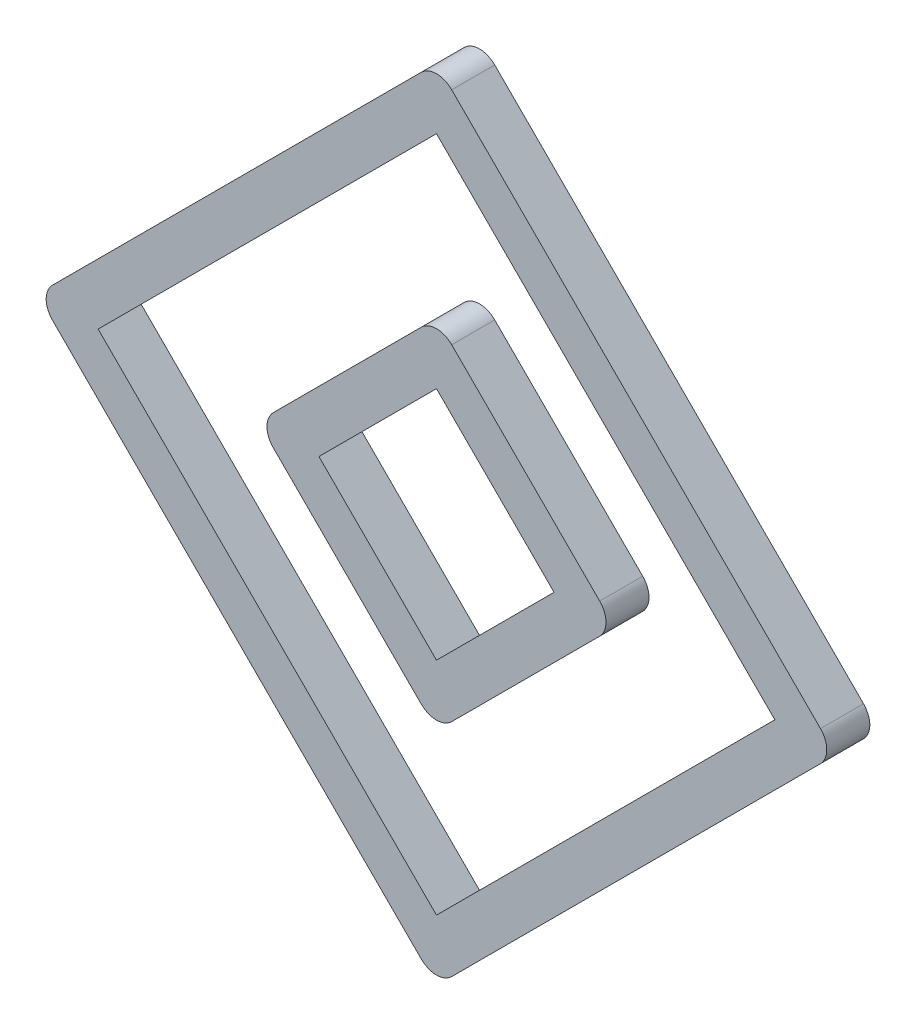
from build123d import *

# Parameters (mm, degrees)
BOSS_EXTRUDE1_DEPTH   = 1.75
BOSS_EXTRUDE1_2_DEPTH = 1.75


with BuildPart() as part:
    # Sketch2 → Boss-Extrude1 (new body)
    with BuildSketch(Plane.XY):
        with BuildLine():
            Line((-22.376246782, -150.652582773), (-7.376246782, -135.652582773))
            ThreePointArc((-7.376246782, -135.652582773), (-7.119965216, -135.03386434), (-7.376246782, -134.415145906))
            Line((-7.376246782, -134.415145906), (-22.376246782, -119.415145906))
            ThreePointArc((-22.376246782, -119.415145906), (-22.994965216, -119.15886434), (-23.613683649, -119.415145906))
            Line((-23.613683649, -119.415145906), (-38.613683649, -134.415145906))
            ThreePointArc((-38.613683649, -134.415145906), (-38.869965216, -135.03386434), (-38.613683649, -135.652582773))
            Line((-38.613683649, -135.652582773), (-23.613683649, -150.652582773))
            ThreePointArc((-23.613683649, -150.652582773), (-22.994965216, -150.90886434), (-22.376246782, -150.652582773))
        make_face()
        Polygon((-22.994965216, -121.271301207), (-9.232402083, -135.03386434), (-22.994965216, -148.796427473), (-36.757528349, -135.03386434), align=None, mode=Mode.SUBTRACT)
    extrude(amount=-BOSS_EXTRUDE1_DEPTH)


with BuildPart() as body_2:
    # Sketch2 → Boss-Extrude1 2 (new body)
    with BuildSketch(Plane.XY):
        with BuildLine():
            Line((-22.376246782, -141.672326652), (-16.356502903, -135.652582773))
            ThreePointArc((-16.356502903, -135.652582773), (-16.100221337, -135.03386434), (-16.356502903, -134.415145906))
            Line((-16.356502903, -134.415145906), (-22.376246782, -128.395402027))
            ThreePointArc((-22.376246782, -128.395402027), (-22.994965216, -128.139120461), (-23.613683649, -128.395402027))
            Line((-23.613683649, -128.395402027), (-29.633427528, -134.415145906))
            ThreePointArc((-29.633427528, -134.415145906), (-29.889709095, -135.03386434), (-29.633427528, -135.652582773))
            Line((-29.633427528, -135.652582773), (-23.613683649, -141.672326652))
            ThreePointArc((-23.613683649, -141.672326652), (-22.994965216, -141.928608219), (-22.376246782, -141.672326652))
        make_face()
        Polygon((-22.994965216, -130.251557328), (-18.212658204, -135.03386434), (-22.994965216, -139.816171352), (-27.777272227, -135.03386434), align=None, mode=Mode.SUBTRACT)
    extrude(amount=-BOSS_EXTRUDE1_2_DEPTH)


solid = Compound([part.part, body_2.part])
